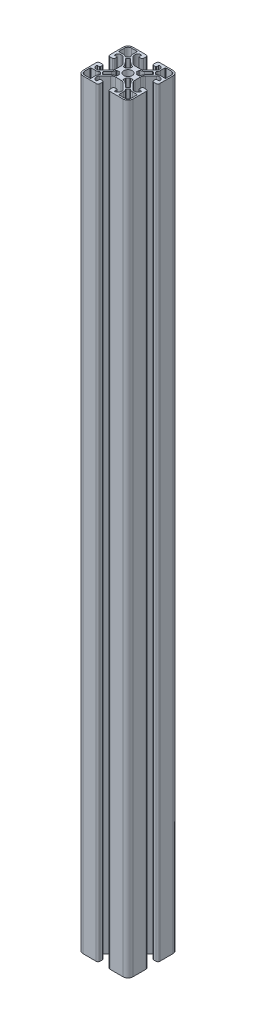
from build123d import *

# Parameters (mm, degrees)
BOSS_EXTRUDE1_DEPTH = 610


with BuildPart() as part:
    # Sketch1 → Boss-Extrude1 (new body)
    with BuildSketch(Plane.XZ):
        with BuildLine():
            ThreePointArc((7.74999966, 2.143146426), (8.054481613, 3.673880349), (8.921572842, 4.971573842))
            Line((8.921572842, 4.971573842), (13.364213585, 9.414213585))
            ThreePointArc((13.364213585, 9.414213585), (14.013060246, 9.847758984), (14.778427028, 9.99999988))
            Line((14.778427028, 9.99999988), (15.49999999, 9.99999988))
            ThreePointArc((15.49999999, 9.99999988), (17.267766945, 9.267766835), (18, 7.499999885))
            ThreePointArc((18, 7.499999885), (17.853553391, 7.146446491), (17.499999998, 6.99999988))
            Line((17.499999998, 6.99999988), (16.000000002, 6.99999988))
            ThreePointArc((16.000000002, 6.99999988), (15.64644661, 6.85355327), (15.5, 6.499999878))
            Line((15.5, 6.499999878), (15.5, 4.999999884))
            ThreePointArc((15.5, 4.999999884), (15.79289322, 4.2928931), (16.500000004, 3.99999988))
            Line((16.500000004, 3.99999988), (18.499999994, 3.99999988))
            ThreePointArc((18.499999994, 3.99999988), (19.56066017, 4.43933971), (20, 5.499999886))
            Line((20, 5.499999886), (20, 16))
            ThreePointArc((20, 16), (18.828427125, 18.828427125), (16, 20))
            Line((16, 20), (5.500000703, 20))
            ThreePointArc((5.500000703, 20), (4.439339115, 19.560659585), (3.9999987, 18.499997997))
            Line((3.9999987, 18.499997997), (3.9999987, 16.500000004))
            ThreePointArc((3.9999987, 16.500000004), (4.29289192, 15.79289322), (4.999998704, 15.5))
            Line((4.999998704, 15.5), (6.499998698, 15.5))
            ThreePointArc((6.499998698, 15.5), (6.85355209, 15.64644661), (6.9999987, 16.000000002))
            Line((6.9999987, 16.000000002), (6.9999987, 17.499999998))
            ThreePointArc((6.9999987, 17.499999998), (7.146445288, 17.853553368), (7.49999864, 18))
            ThreePointArc((7.49999864, 18), (9.2677658, 17.26776706), (9.99999896, 15.49999999))
            Line((9.99999896, 15.49999999), (9.99999896, 14.778427028))
            ThreePointArc((9.99999896, 14.778427028), (9.847758064, 14.013060246), (9.414212665, 13.364213585))
            Line((9.414212665, 13.364213585), (4.971572922, 8.921572842))
            ThreePointArc((4.971572922, 8.921572842), (3.673879429, 8.054481613), (2.143145506, 7.74999966))
            Line((2.143145506, 7.74999966), (-2.143146426, 7.74999966))
            ThreePointArc((-2.143146426, 7.74999966), (-3.673880349, 8.054481613), (-4.971573842, 8.921572842))
            Line((-4.971573842, 8.921572842), (-9.414213585, 13.364213585))
            ThreePointArc((-9.414213585, 13.364213585), (-9.847758984, 14.013060246), (-9.99999988, 14.778427028))
            Line((-9.99999988, 14.778427028), (-9.99999988, 15.49999999))
            ThreePointArc((-9.99999988, 15.49999999), (-9.267766835, 17.267766945), (-7.499999885, 18))
            ThreePointArc((-7.499999885, 18), (-7.146446491, 17.853553391), (-6.99999988, 17.499999998))
            Line((-6.99999988, 17.499999998), (-6.99999988, 16.000000002))
            ThreePointArc((-6.99999988, 16.000000002), (-6.85355327, 15.64644661), (-6.499999878, 15.5))
            Line((-6.499999878, 15.5), (-4.999999884, 15.5))
            ThreePointArc((-4.999999884, 15.5), (-4.2928931, 15.79289322), (-3.99999988, 16.500000004))
            Line((-3.99999988, 16.500000004), (-3.99999988, 18.499999994))
            ThreePointArc((-3.99999988, 18.499999994), (-4.43933971, 19.56066017), (-5.499999886, 20))
            Line((-5.499999886, 20), (-16, 20))
            ThreePointArc((-16, 20), (-18.828427125, 18.828427125), (-20, 16))
            Line((-20, 16), (-20, 5.500000703))
            ThreePointArc((-20, 5.500000703), (-19.560659585, 4.439339115), (-18.499997997, 3.9999987))
            Line((-18.499997997, 3.9999987), (-16.500000004, 3.9999987))
            ThreePointArc((-16.500000004, 3.9999987), (-15.79289322, 4.29289192), (-15.5, 4.999998704))
            Line((-15.5, 4.999998704), (-15.5, 6.499998698))
            ThreePointArc((-15.5, 6.499998698), (-15.64644661, 6.85355209), (-16.000000002, 6.9999987))
            Line((-16.000000002, 6.9999987), (-17.499999998, 6.9999987))
            ThreePointArc((-17.499999998, 6.9999987), (-17.853553368, 7.146445288), (-18, 7.49999864))
            ThreePointArc((-18, 7.49999864), (-17.26776706, 9.2677658), (-15.49999999, 9.99999896))
            Line((-15.49999999, 9.99999896), (-14.778427028, 9.99999896))
            ThreePointArc((-14.778427028, 9.99999896), (-14.013060246, 9.847758064), (-13.364213585, 9.414212665))
            Line((-13.364213585, 9.414212665), (-8.921572842, 4.971572922))
            ThreePointArc((-8.921572842, 4.971572922), (-8.054481613, 3.673879429), (-7.74999966, 2.143145506))
            Line((-7.74999966, 2.143145506), (-7.74999966, -2.143146426))
            ThreePointArc((-7.74999966, -2.143146426), (-8.054481613, -3.673880349), (-8.921572842, -4.971573842))
            Line((-8.921572842, -4.971573842), (-13.364213585, -9.414213585))
            ThreePointArc((-13.364213585, -9.414213585), (-14.013060246, -9.847758984), (-14.778427028, -9.99999988))
            Line((-14.778427028, -9.99999988), (-15.49999999, -9.99999988))
            ThreePointArc((-15.49999999, -9.99999988), (-17.267766945, -9.267766835), (-18, -7.499999885))
            ThreePointArc((-18, -7.499999885), (-17.853553391, -7.146446491), (-17.499999998, -6.99999988))
            Line((-17.499999998, -6.99999988), (-16.000000002, -6.99999988))
            ThreePointArc((-16.000000002, -6.99999988), (-15.64644661, -6.85355327), (-15.5, -6.499999878))
            Line((-15.5, -6.499999878), (-15.5, -4.999999884))
            ThreePointArc((-15.5, -4.999999884), (-15.79289322, -4.2928931), (-16.500000004, -3.99999988))
            Line((-16.500000004, -3.99999988), (-18.499999994, -3.99999988))
            ThreePointArc((-18.499999994, -3.99999988), (-19.56066017, -4.43933971), (-20, -5.499999886))
            Line((-20, -5.499999886), (-20, -16))
            ThreePointArc((-20, -16), (-18.828427125, -18.828427125), (-16, -20))
            Line((-16, -20), (-5.500000703, -20))
            ThreePointArc((-5.500000703, -20), (-4.439339115, -19.560659585), (-3.9999987, -18.499997997))
            Line((-3.9999987, -18.499997997), (-3.9999987, -16.500000004))
            ThreePointArc((-3.9999987, -16.500000004), (-4.29289192, -15.79289322), (-4.999998704, -15.5))
            Line((-4.999998704, -15.5), (-6.499998698, -15.5))
            ThreePointArc((-6.499998698, -15.5), (-6.85355209, -15.64644661), (-6.9999987, -16.000000002))
            Line((-6.9999987, -16.000000002), (-6.9999987, -17.499999998))
            ThreePointArc((-6.9999987, -17.499999998), (-7.146445288, -17.853553368), (-7.49999864, -18))
            ThreePointArc((-7.49999864, -18), (-9.2677658, -17.26776706), (-9.99999896, -15.49999999))
            Line((-9.99999896, -15.49999999), (-9.99999896, -14.778427028))
            ThreePointArc((-9.99999896, -14.778427028), (-9.847758064, -14.013060246), (-9.414212665, -13.364213585))
            Line((-9.414212665, -13.364213585), (-4.971572922, -8.921572842))
            ThreePointArc((-4.971572922, -8.921572842), (-3.673879429, -8.054481613), (-2.143145506, -7.74999966))
            Line((-2.143145506, -7.74999966), (2.143146426, -7.74999966))
            ThreePointArc((2.143146426, -7.74999966), (3.673880349, -8.054481613), (4.971573842, -8.921572842))
            Line((4.971573842, -8.921572842), (9.414213585, -13.364213585))
            ThreePointArc((9.414213585, -13.364213585), (9.847758984, -14.013060246), (9.99999988, -14.778427028))
            Line((9.99999988, -14.778427028), (9.99999988, -15.49999999))
            ThreePointArc((9.99999988, -15.49999999), (9.267766835, -17.267766945), (7.499999885, -18))
            ThreePointArc((7.499999885, -18), (7.146446491, -17.853553391), (6.99999988, -17.499999998))
            Line((6.99999988, -17.499999998), (6.99999988, -16.000000002))
            ThreePointArc((6.99999988, -16.000000002), (6.85355327, -15.64644661), (6.499999878, -15.5))
            Line((6.499999878, -15.5), (4.999999884, -15.5))
            ThreePointArc((4.999999884, -15.5), (4.2928931, -15.79289322), (3.99999988, -16.500000004))
            Line((3.99999988, -16.500000004), (3.99999988, -18.499999994))
            ThreePointArc((3.99999988, -18.499999994), (4.43933971, -19.56066017), (5.499999886, -20))
            Line((5.499999886, -20), (16, -20))
            ThreePointArc((16, -20), (18.828427125, -18.828427125), (20, -16))
            Line((20, -16), (20, -5.500000703))
            ThreePointArc((20, -5.500000703), (19.560659585, -4.439339115), (18.499997997, -3.9999987))
            Line((18.499997997, -3.9999987), (16.500000004, -3.9999987))
            ThreePointArc((16.500000004, -3.9999987), (15.79289322, -4.29289192), (15.5, -4.999998704))
            Line((15.5, -4.999998704), (15.5, -6.499998698))
            ThreePointArc((15.5, -6.499998698), (15.64644661, -6.85355209), (16.000000002, -6.9999987))
            Line((16.000000002, -6.9999987), (17.499999998, -6.9999987))
            ThreePointArc((17.499999998, -6.9999987), (17.853553368, -7.146445288), (18, -7.49999864))
            ThreePointArc((18, -7.49999864), (17.26776706, -9.2677658), (15.49999999, -9.99999896))
            Line((15.49999999, -9.99999896), (14.778427028, -9.99999896))
            ThreePointArc((14.778427028, -9.99999896), (14.013060246, -9.847758064), (13.364213585, -9.414212665))
            Line((13.364213585, -9.414212665), (8.921572842, -4.971572922))
            ThreePointArc((8.921572842, -4.971572922), (8.054481613, -3.673879429), (7.74999966, -2.143145506))
            Line((7.74999966, -2.143145506), (7.74999966, 2.143146426))
        make_face()
        with BuildLine():
            Line((-10.309842412, -12.441125736), (-10.537754292, -12.737838278))
            ThreePointArc((-10.537754292, -12.737838278), (-11.029918756, -13.657781351), (-11.20000018, -14.687146897))
            Line((-11.20000018, -14.687146897), (-11.20000018, -18.299999665))
            ThreePointArc((-11.20000018, -18.299999665), (-11.346446785, -18.653553045), (-11.700000165, -18.79999965))
            Line((-11.700000165, -18.79999965), (-15.999998999, -18.79999965))
            ThreePointArc((-15.999998999, -18.79999965), (-17.97989798, -17.97989864), (-18.79999899, -15.999999659))
            Line((-18.79999899, -15.999999659), (-18.79999899, -11.700000652))
            ThreePointArc((-18.79999899, -11.700000652), (-18.65355238, -11.34644726), (-18.299998988, -11.20000065))
            Line((-18.299998988, -11.20000065), (-14.687147242, -11.20000065))
            ThreePointArc((-14.687147242, -11.20000065), (-13.657781701, -11.029919227), (-12.737838631, -10.537754765))
            Line((-12.737838631, -10.537754765), (-12.441126454, -10.309843165))
            ThreePointArc((-12.441126454, -10.309843165), (-12.103969645, -10.207429365), (-11.782992043, -10.352813957))
            Line((-11.782992043, -10.352813957), (-10.352813101, -11.782992899))
            ThreePointArc((-10.352813101, -11.782992899), (-10.207428857, -12.103969733), (-10.309842412, -12.441125736))
        make_face(mode=Mode.SUBTRACT)
        with BuildLine():
            Line((-2.49999982, -4.612548562), (-2.49999982, -6.181005536))
            ThreePointArc((-2.49999982, -6.181005536), (-2.622288189, -6.508624104), (-2.929335517, -6.675986912))
            ThreePointArc((-2.929335517, -6.675986912), (-4.217639104, -7.033530984), (-5.372191903, -7.707750332))
            ThreePointArc((-5.372191903, -7.707750332), (-7.142926579, -9.204438637), (-8.77441042, -10.851811592))
            ThreePointArc((-8.77441042, -10.851811592), (-9.132617059, -11.015888701), (-9.498445987, -10.869592803))
            Line((-9.498445987, -10.869592803), (-10.869594172, -9.498444618))
            ThreePointArc((-10.869594172, -9.498444618), (-11.01589007, -9.132615689), (-10.851812962, -8.774409049))
            ThreePointArc((-10.851812962, -8.774409049), (-9.204439994, -7.142925196), (-7.707751679, -5.372190504))
            ThreePointArc((-7.707751679, -5.372190504), (-7.03353234, -4.217637712), (-6.67598828, -2.929334132))
            ThreePointArc((-6.67598828, -2.929334132), (-6.50862548, -2.622286815), (-6.181006925, -2.49999845))
            Line((-6.181006925, -2.49999845), (-4.612550475, -2.49999845))
            ThreePointArc((-4.612550475, -2.49999845), (-4.374103707, -2.560517653), (-4.193379151, -2.727425022))
            ThreePointArc((-4.193379151, -2.727425022), (-3.537216107, -3.537215713), (-2.727425489, -4.193378848))
            ThreePointArc((-2.727425489, -4.193378848), (-2.560518782, -4.374102717), (-2.49999982, -4.612548562))
        make_face(mode=Mode.SUBTRACT)
        with BuildLine():
            Line((12.441125736, -10.309842412), (12.737838278, -10.537754292))
            ThreePointArc((12.737838278, -10.537754292), (13.657781351, -11.029918756), (14.687146897, -11.20000018))
            Line((14.687146897, -11.20000018), (18.299999665, -11.20000018))
            ThreePointArc((18.299999665, -11.20000018), (18.653553045, -11.346446785), (18.79999965, -11.700000165))
            Line((18.79999965, -11.700000165), (18.79999965, -15.999998999))
            ThreePointArc((18.79999965, -15.999998999), (17.97989864, -17.97989798), (15.999999659, -18.79999899))
            Line((15.999999659, -18.79999899), (11.700000652, -18.79999899))
            ThreePointArc((11.700000652, -18.79999899), (11.34644726, -18.65355238), (11.20000065, -18.299998988))
            Line((11.20000065, -18.299998988), (11.20000065, -14.687147242))
            ThreePointArc((11.20000065, -14.687147242), (11.029919227, -13.657781701), (10.537754765, -12.737838631))
            Line((10.537754765, -12.737838631), (10.309843165, -12.441126454))
            ThreePointArc((10.309843165, -12.441126454), (10.207429365, -12.103969645), (10.352813957, -11.782992043))
            Line((10.352813957, -11.782992043), (11.782992899, -10.352813101))
            ThreePointArc((11.782992899, -10.352813101), (12.103969733, -10.207428857), (12.441125736, -10.309842412))
        make_face(mode=Mode.SUBTRACT)
        with BuildLine():
            Line((4.612548562, -2.49999982), (6.181005536, -2.49999982))
            ThreePointArc((6.181005536, -2.49999982), (6.508624104, -2.622288189), (6.675986912, -2.929335517))
            ThreePointArc((6.675986912, -2.929335517), (7.033530984, -4.217639104), (7.707750332, -5.372191903))
            ThreePointArc((7.707750332, -5.372191903), (9.204438637, -7.142926579), (10.851811592, -8.77441042))
            ThreePointArc((10.851811592, -8.77441042), (11.015888701, -9.132617059), (10.869592803, -9.498445987))
            Line((10.869592803, -9.498445987), (9.498444618, -10.869594172))
            ThreePointArc((9.498444618, -10.869594172), (9.132615689, -11.01589007), (8.774409049, -10.851812962))
            ThreePointArc((8.774409049, -10.851812962), (7.142925196, -9.204439994), (5.372190504, -7.707751679))
            ThreePointArc((5.372190504, -7.707751679), (4.217637712, -7.03353234), (2.929334132, -6.67598828))
            ThreePointArc((2.929334132, -6.67598828), (2.622286815, -6.50862548), (2.49999845, -6.181006925))
            Line((2.49999845, -6.181006925), (2.49999845, -4.612550475))
            ThreePointArc((2.49999845, -4.612550475), (2.560517653, -4.374103707), (2.727425022, -4.193379151))
            ThreePointArc((2.727425022, -4.193379151), (3.537215713, -3.537216107), (4.193378848, -2.727425489))
            ThreePointArc((4.193378848, -2.727425489), (4.374102717, -2.560518782), (4.612548562, -2.49999982))
        make_face(mode=Mode.SUBTRACT)
        with BuildLine():
            Line((-4.612548562, 2.49999982), (-6.181005536, 2.49999982))
            ThreePointArc((-6.181005536, 2.49999982), (-6.508624104, 2.622288189), (-6.675986912, 2.929335517))
            ThreePointArc((-6.675986912, 2.929335517), (-7.033530984, 4.217639104), (-7.707750332, 5.372191903))
            ThreePointArc((-7.707750332, 5.372191903), (-9.204438637, 7.142926579), (-10.851811592, 8.77441042))
            ThreePointArc((-10.851811592, 8.77441042), (-11.015888701, 9.132617059), (-10.869592803, 9.498445987))
            Line((-10.869592803, 9.498445987), (-9.498444618, 10.869594172))
            ThreePointArc((-9.498444618, 10.869594172), (-9.132615689, 11.01589007), (-8.774409049, 10.851812962))
            ThreePointArc((-8.774409049, 10.851812962), (-7.142925196, 9.204439994), (-5.372190504, 7.707751679))
            ThreePointArc((-5.372190504, 7.707751679), (-4.217637712, 7.03353234), (-2.929334132, 6.67598828))
            ThreePointArc((-2.929334132, 6.67598828), (-2.622286815, 6.50862548), (-2.49999845, 6.181006925))
            Line((-2.49999845, 6.181006925), (-2.49999845, 4.612550475))
            ThreePointArc((-2.49999845, 4.612550475), (-2.560517653, 4.374103707), (-2.727425022, 4.193379151))
            ThreePointArc((-2.727425022, 4.193379151), (-3.537215713, 3.537216107), (-4.193378848, 2.727425489))
            ThreePointArc((-4.193378848, 2.727425489), (-4.374102717, 2.560518782), (-4.612548562, 2.49999982))
        make_face(mode=Mode.SUBTRACT)
        with BuildLine():
            Line((-12.441125736, 10.309842412), (-12.737838278, 10.537754292))
            ThreePointArc((-12.737838278, 10.537754292), (-13.657781351, 11.029918756), (-14.687146897, 11.20000018))
            Line((-14.687146897, 11.20000018), (-18.299999665, 11.20000018))
            ThreePointArc((-18.299999665, 11.20000018), (-18.653553045, 11.346446785), (-18.79999965, 11.700000165))
            Line((-18.79999965, 11.700000165), (-18.79999965, 15.999998999))
            ThreePointArc((-18.79999965, 15.999998999), (-17.97989864, 17.97989798), (-15.999999659, 18.79999899))
            Line((-15.999999659, 18.79999899), (-11.700000652, 18.79999899))
            ThreePointArc((-11.700000652, 18.79999899), (-11.34644726, 18.65355238), (-11.20000065, 18.299998988))
            Line((-11.20000065, 18.299998988), (-11.20000065, 14.687147242))
            ThreePointArc((-11.20000065, 14.687147242), (-11.029919227, 13.657781701), (-10.537754765, 12.737838631))
            Line((-10.537754765, 12.737838631), (-10.309843165, 12.441126454))
            ThreePointArc((-10.309843165, 12.441126454), (-10.207429365, 12.103969645), (-10.352813957, 11.782992043))
            Line((-10.352813957, 11.782992043), (-11.782992899, 10.352813101))
            ThreePointArc((-11.782992899, 10.352813101), (-12.103969733, 10.207428857), (-12.441125736, 10.309842412))
        make_face(mode=Mode.SUBTRACT)
        with BuildLine():
            ThreePointArc((-3.4, 0), (-2.404163056, 2.404163056), (0, 3.4))
            ThreePointArc((0, 3.4), (2.404163056, 2.404163056), (3.4, 0))
            ThreePointArc((3.4, 0), (2.404163056, -2.404163056), (0, -3.4))
            ThreePointArc((0, -3.4), (-2.404163056, -2.404163056), (-3.4, 0))
        make_face(mode=Mode.SUBTRACT)
        with BuildLine():
            Line((2.49999982, 4.612548562), (2.49999982, 6.181005536))
            ThreePointArc((2.49999982, 6.181005536), (2.622288189, 6.508624104), (2.929335517, 6.675986912))
            ThreePointArc((2.929335517, 6.675986912), (4.217639104, 7.033530984), (5.372191903, 7.707750332))
            ThreePointArc((5.372191903, 7.707750332), (7.142926579, 9.204438637), (8.77441042, 10.851811592))
            ThreePointArc((8.77441042, 10.851811592), (9.132617059, 11.015888701), (9.498445987, 10.869592803))
            Line((9.498445987, 10.869592803), (10.869594172, 9.498444618))
            ThreePointArc((10.869594172, 9.498444618), (11.01589007, 9.132615689), (10.851812962, 8.774409049))
            ThreePointArc((10.851812962, 8.774409049), (9.204439994, 7.142925196), (7.707751679, 5.372190504))
            ThreePointArc((7.707751679, 5.372190504), (7.03353234, 4.217637712), (6.67598828, 2.929334132))
            ThreePointArc((6.67598828, 2.929334132), (6.50862548, 2.622286815), (6.181006925, 2.49999845))
            Line((6.181006925, 2.49999845), (4.612550475, 2.49999845))
            ThreePointArc((4.612550475, 2.49999845), (4.374103707, 2.560517653), (4.193379151, 2.727425022))
            ThreePointArc((4.193379151, 2.727425022), (3.537216107, 3.537215713), (2.727425489, 4.193378848))
            ThreePointArc((2.727425489, 4.193378848), (2.560518782, 4.374102717), (2.49999982, 4.612548562))
        make_face(mode=Mode.SUBTRACT)
        with BuildLine():
            Line((10.309842412, 12.441125736), (10.537754292, 12.737838278))
            ThreePointArc((10.537754292, 12.737838278), (11.029918756, 13.657781351), (11.20000018, 14.687146897))
            Line((11.20000018, 14.687146897), (11.20000018, 18.299999665))
            ThreePointArc((11.20000018, 18.299999665), (11.346446785, 18.653553045), (11.700000165, 18.79999965))
            Line((11.700000165, 18.79999965), (15.999998999, 18.79999965))
            ThreePointArc((15.999998999, 18.79999965), (17.97989798, 17.97989864), (18.79999899, 15.999999659))
            Line((18.79999899, 15.999999659), (18.79999899, 11.700000652))
            ThreePointArc((18.79999899, 11.700000652), (18.65355238, 11.34644726), (18.299998988, 11.20000065))
            Line((18.299998988, 11.20000065), (14.687147242, 11.20000065))
            ThreePointArc((14.687147242, 11.20000065), (13.657781701, 11.029919227), (12.737838631, 10.537754765))
            Line((12.737838631, 10.537754765), (12.441126454, 10.309843165))
            ThreePointArc((12.441126454, 10.309843165), (12.103969645, 10.207429365), (11.782992043, 10.352813957))
            Line((11.782992043, 10.352813957), (10.352813101, 11.782992899))
            ThreePointArc((10.352813101, 11.782992899), (10.207428857, 12.103969733), (10.309842412, 12.441125736))
        make_face(mode=Mode.SUBTRACT)
    extrude(amount=-BOSS_EXTRUDE1_DEPTH)


solid = part.part
